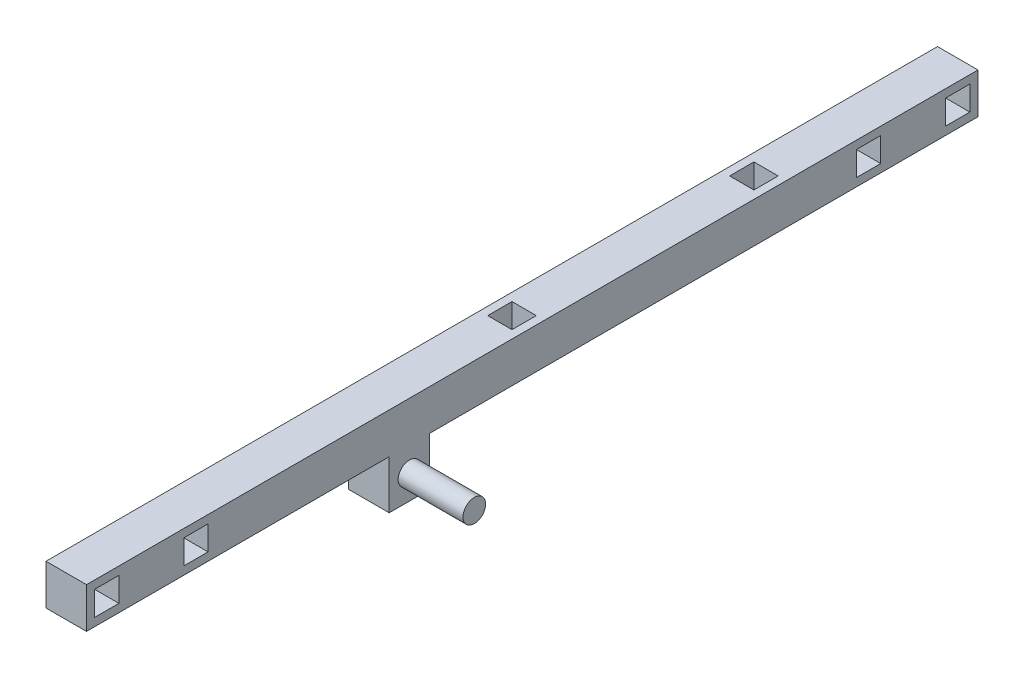
from build123d import *

# Parameters (mm, degrees)
SKETCH1_W           = 5
SKETCH1_H           = 5
BOSS_EXTRUDE1_DEPTH = 110
SKETCH2_W           = 3
SKETCH2_H           = 3
CUT_EXTRUDE1_DEPTH  = 9
SKETCH3_W           = 3
SKETCH3_H           = 3
CUT_EXTRUDE2_DEPTH  = 9
SKETCH4_W           = 5
SKETCH4_H           = 5
BOSS_EXTRUDE2_DEPTH = 6
SKETCH5_R           = 1.4
BOSS_EXTRUDE3_DEPTH = 13


with BuildPart() as part:
    # Sketch1 → Boss-Extrude1 (new body)
    with BuildSketch(Plane.XY):
        with Locations((2.5, 2.5)):
            Rectangle(SKETCH1_W, SKETCH1_H)
    extrude(amount=BOSS_EXTRUDE1_DEPTH)

    # Sketch2 → Cut-Extrude1 (cut)
    with BuildSketch(Plane.ZY):
        with Locations((2.5, 2.5)):
            Rectangle(SKETCH2_W, SKETCH2_H)
        with Locations((107.5, 2.5)):
            Rectangle(SKETCH2_W, SKETCH2_H)
        with Locations((13.5, 2.5)):
            Rectangle(SKETCH2_W, SKETCH2_H)
        with Locations((96.5, 2.5)):
            Rectangle(SKETCH2_W, SKETCH2_H)
    extrude(amount=-CUT_EXTRUDE1_DEPTH, mode=Mode.SUBTRACT)

    # Sketch3 → Cut-Extrude2 (cut)
    with BuildSketch(Plane(origin=(0, 5, 0), x_dir=(1, 0, 0), z_dir=(0, 1, 0))):
        with Locations((2.5, -25.15)):
            Rectangle(SKETCH3_W, SKETCH3_H)
        with Locations((2.5, -55)):
            Rectangle(SKETCH3_W, SKETCH3_H)
    extrude(amount=-CUT_EXTRUDE2_DEPTH, mode=Mode.SUBTRACT)

    # Sketch4 → Boss-Extrude2 (add)
    with BuildSketch(Plane(origin=(0, 0, 0), x_dir=(-1, 0, 0), z_dir=(0, -1, 0))):
        with Locations((-2.5, -70.15)):
            Rectangle(SKETCH4_W, SKETCH4_H)
    extrude(amount=BOSS_EXTRUDE2_DEPTH)

    # Sketch5 → Boss-Extrude3 (add)
    with BuildSketch(Plane.ZY):
        with Locations((70.15, -3)):
            Circle(SKETCH5_R)
    extrude(amount=-BOSS_EXTRUDE3_DEPTH)


solid = part.part
